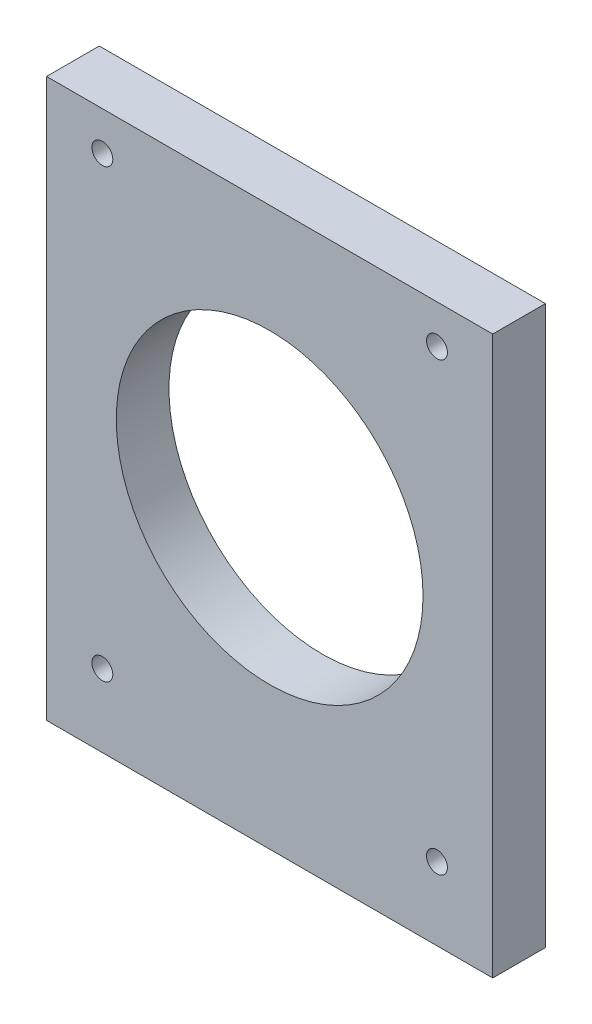
from build123d import *

# Parameters (mm, degrees)
SKETCH1_W           = 101.6
SKETCH1_H           = 127
SKETCH1_R           = 34.925
SKETCH1_R_2         = 2.38125
BOSS_EXTRUDE1_DEPTH = 12.0000014


with BuildPart() as part:
    # Sketch1 → Boss-Extrude1 (new body)
    with BuildSketch(Plane.XY):
        with Locations((-5.865955003, 66.422081082)):
            Rectangle(SKETCH1_W, SKETCH1_H)
        with Locations((-5.865955003, 70.297079682)):
            Circle(SKETCH1_R, mode=Mode.SUBTRACT)
        with Locations((-43.965955003, 121.097079682)):
            Circle(SKETCH1_R_2, mode=Mode.SUBTRACT)
        with Locations((32.234044997, 121.097079682)):
            Circle(SKETCH1_R_2, mode=Mode.SUBTRACT)
        with Locations((-43.965955003, 19.497079682)):
            Circle(SKETCH1_R_2, mode=Mode.SUBTRACT)
        with Locations((32.234044997, 19.497079682)):
            Circle(SKETCH1_R_2, mode=Mode.SUBTRACT)
    extrude(amount=BOSS_EXTRUDE1_DEPTH)


solid = part.part
